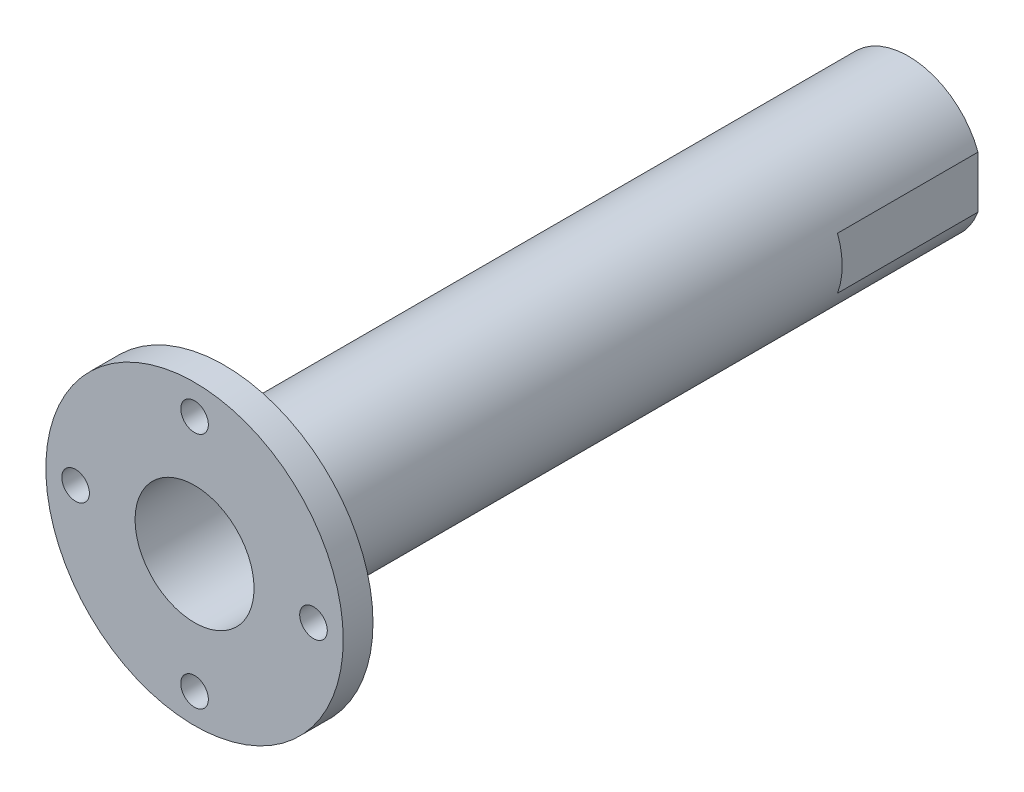
from build123d import *

# Parameters (mm, degrees)
SKETCH1_R                 = 7.9375
SKETCH1_R_2               = 6.35
BOSS_EXTRUDE1_DEPTH       = 76.2
BOSS_EXTRUDE2_START       = -3.175
SKETCH2_R                 = 15.875
SKETCH2_R_2               = 6.35
BOSS_EXTRUDE2_DEPTH       = 3.175
F_4_CLEARANCE_HOLE1_D     = 2.9464
F_4_CLEARANCE_HOLE1_DEPTH = 4
F_4_CLEARANCE_HOLE1_TIP   = 0.885187864
CUT_EXTRUDE1_DEPTH        = 80.43847462
CUT_EXTRUDE1_DEPTH_BACK   = 80.43847462
SKETCH6_W                 = 4.137147463
SKETCH6_H                 = 15


with BuildPart() as part:
    # Sketch1 → Boss-Extrude1 (new body)
    with BuildSketch(Plane.XY):
        with Locations(Location((0, 0, 0), (0, 0, 180))):
            Circle(SKETCH1_R)
        with Locations(Location((0, 0, 0), (0, 0, 180))):
            Circle(SKETCH1_R_2, mode=Mode.SUBTRACT)
    extrude(amount=BOSS_EXTRUDE1_DEPTH)

    # Sketch2 → Boss-Extrude2 (add)
    with BuildSketch(Plane.XY.offset(76.2).offset(BOSS_EXTRUDE2_START)):
        Circle(SKETCH2_R)
        with Locations(Location((0, 0, 0), (0, 0, 180))):
            Circle(SKETCH2_R_2, mode=Mode.SUBTRACT)
    extrude(amount=BOSS_EXTRUDE2_DEPTH)

    # #4 Clearance Hole1
    with Locations(Plane.XY.offset(76.2)):
        with Locations((0, 12.7), (0, -12.7), (12.7, 0), (-12.7, 0)):
            Hole(F_4_CLEARANCE_HOLE1_D / 2, depth=F_4_CLEARANCE_HOLE1_DEPTH)
            with Locations((0, 0, -(F_4_CLEARANCE_HOLE1_DEPTH + F_4_CLEARANCE_HOLE1_TIP / 2))):  # 118° drill point
                Cone(0, F_4_CLEARANCE_HOLE1_D / 2, F_4_CLEARANCE_HOLE1_TIP, mode=Mode.SUBTRACT)

    # Sketch6 → Cut-Extrude1 (cut, two sides: drawn at the far end of the back side and taken through both)
    with BuildSketch(Plane(origin=(0, 0, 0), x_dir=(1, 0, 0), z_dir=(0, 1, 0)).offset(-CUT_EXTRUDE1_DEPTH_BACK)):
        with Locations((9.506073732, -7.5)):
            Rectangle(SKETCH6_W, SKETCH6_H)
    extrude(amount=CUT_EXTRUDE1_DEPTH + CUT_EXTRUDE1_DEPTH_BACK, mode=Mode.SUBTRACT)


solid = part.part
